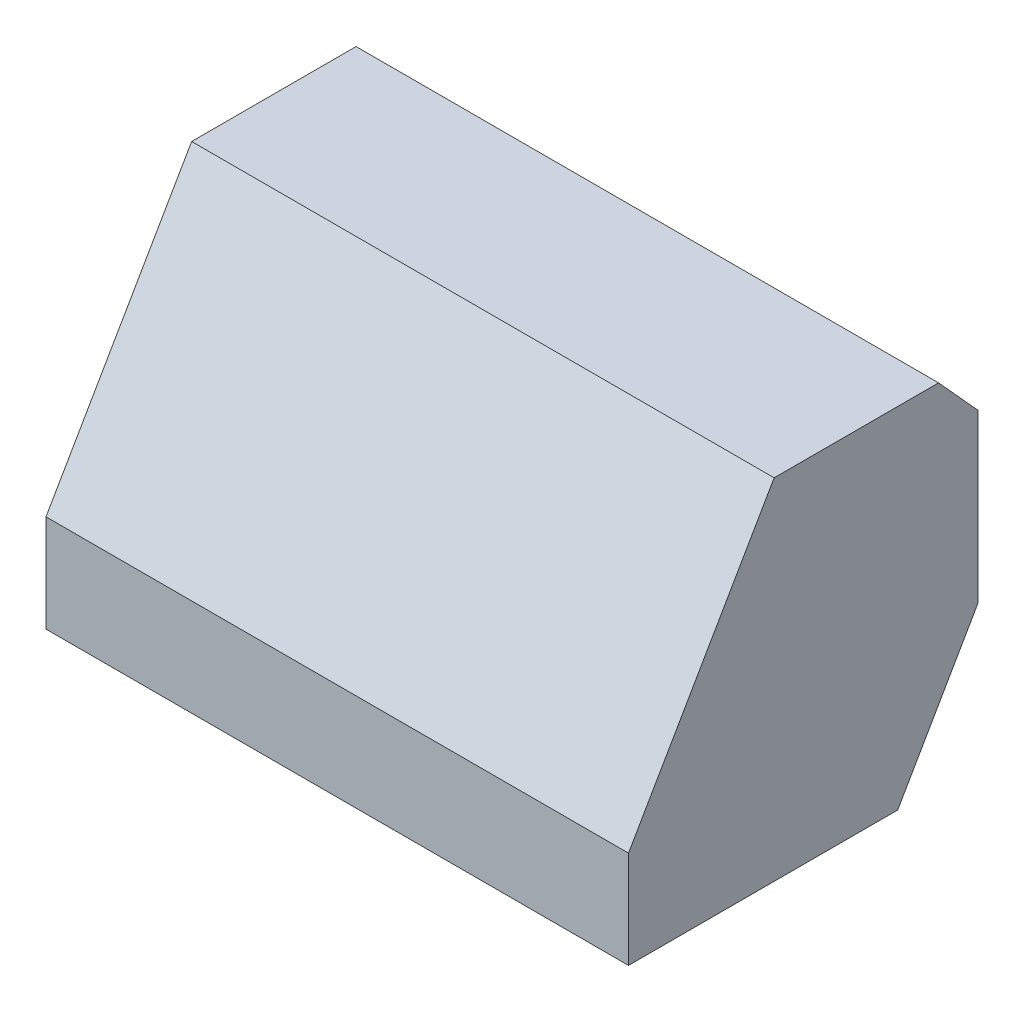
from build123d import *

# Parameters (mm, degrees)
SKETCH1_W           = 100
SKETCH1_H           = 60
BOSS_EXTRUDE1_DEPTH = 60
CUT_EXTRUDE1_DEPTH  = 100


with BuildPart() as part:
    # Sketch1 → Boss-Extrude1 (new body)
    with BuildSketch(Plane(origin=(0, 0, 0), x_dir=(1, 0, 0), z_dir=(0, 1, 0))):
        Rectangle(SKETCH1_W, SKETCH1_H)
    extrude(amount=BOSS_EXTRUDE1_DEPTH)

    # Sketch2 → Cut-Extrude1 (cut)
    with BuildSketch(Plane(origin=(50, 0, 0), x_dir=(0, 0, -1), z_dir=(1, 0, 0))):
        Polygon((-30, 60), (-30, 16.698729811), (-5, 60), align=None)
        Polygon((30, 0), (30, 23.873553173), (16.216597649, 0), align=None)
        Polygon((23.232724571, 60), (30, 60), (30, 52.540618633), align=None)
    extrude(amount=-CUT_EXTRUDE1_DEPTH, mode=Mode.SUBTRACT)


solid = part.part
